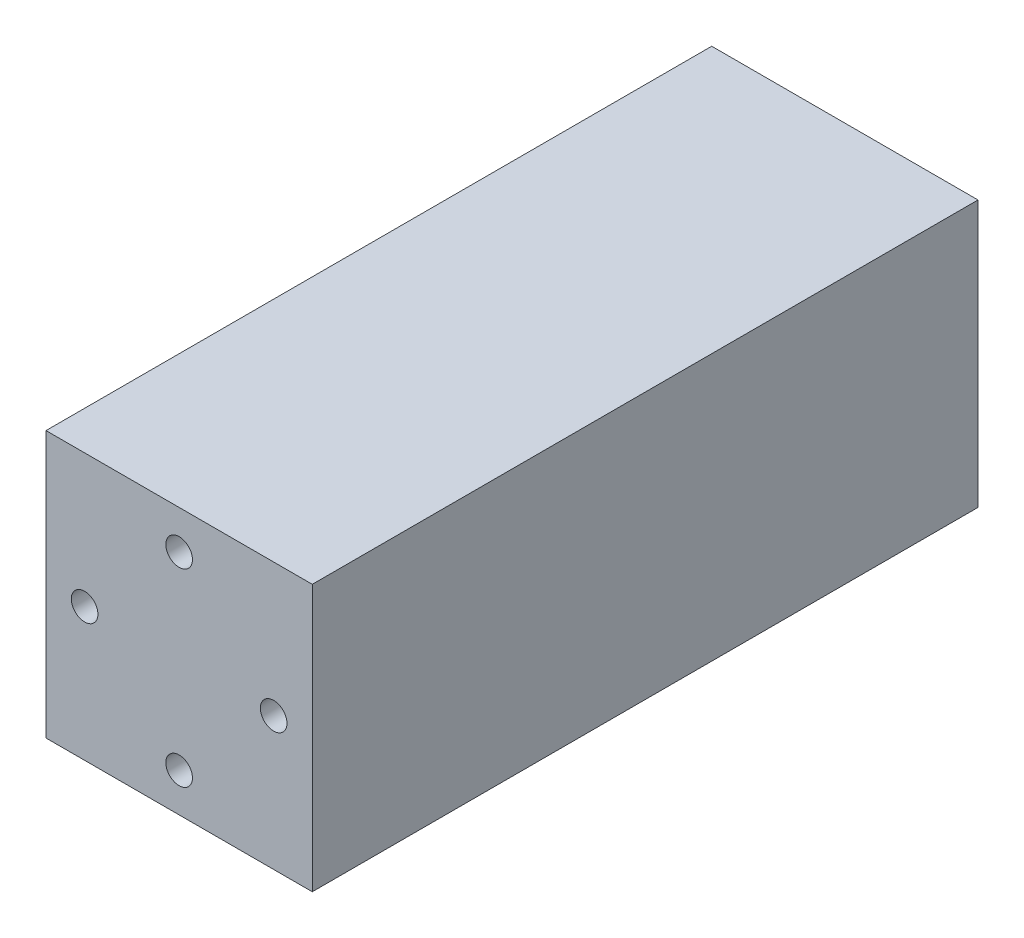
from build123d import *

# Parameters (mm, degrees)
SKETCH_1_W          = 20
SKETCH_1_H          = 20
EXTRUDE_1_DEPTH     = 50
SKETCH_1_3_R        = 1
CUT_EXTRUDE_1_DEPTH = 3
CUT_EXTRUDE_START   = 47
SKETCH_1_4_R        = 1
CUT_EXTRUDE_2_DEPTH = 3


with BuildPart() as part:
    # 草图1 → 凸台-拉伸1 (new body)
    with BuildSketch(Plane.XY):
        Rectangle(SKETCH_1_W, SKETCH_1_H)
    extrude(amount=EXTRUDE_1_DEPTH)

    # 草图1<3> → 切除-拉伸1 (cut)
    with BuildSketch(Plane.XY):
        with Locations((-7.1, 0)):
            Circle(SKETCH_1_3_R)
        with Locations((0, 7.1)):
            Circle(SKETCH_1_3_R)
        with Locations((7.1, 0)):
            Circle(SKETCH_1_3_R)
        with Locations((0, -7.1)):
            Circle(SKETCH_1_3_R)
    extrude(amount=CUT_EXTRUDE_1_DEPTH, mode=Mode.SUBTRACT)

    # 草图1<4> → 切除-拉伸2 (cut)
    with BuildSketch(Plane.XY.offset(CUT_EXTRUDE_START)):
        with Locations((-7.1, 0)):
            Circle(SKETCH_1_4_R)
        with Locations((0, 7.1)):
            Circle(SKETCH_1_4_R)
        with Locations((7.1, 0)):
            Circle(SKETCH_1_4_R)
        with Locations((0, -7.1)):
            Circle(SKETCH_1_4_R)
    extrude(amount=CUT_EXTRUDE_2_DEPTH, mode=Mode.SUBTRACT)


solid = part.part
